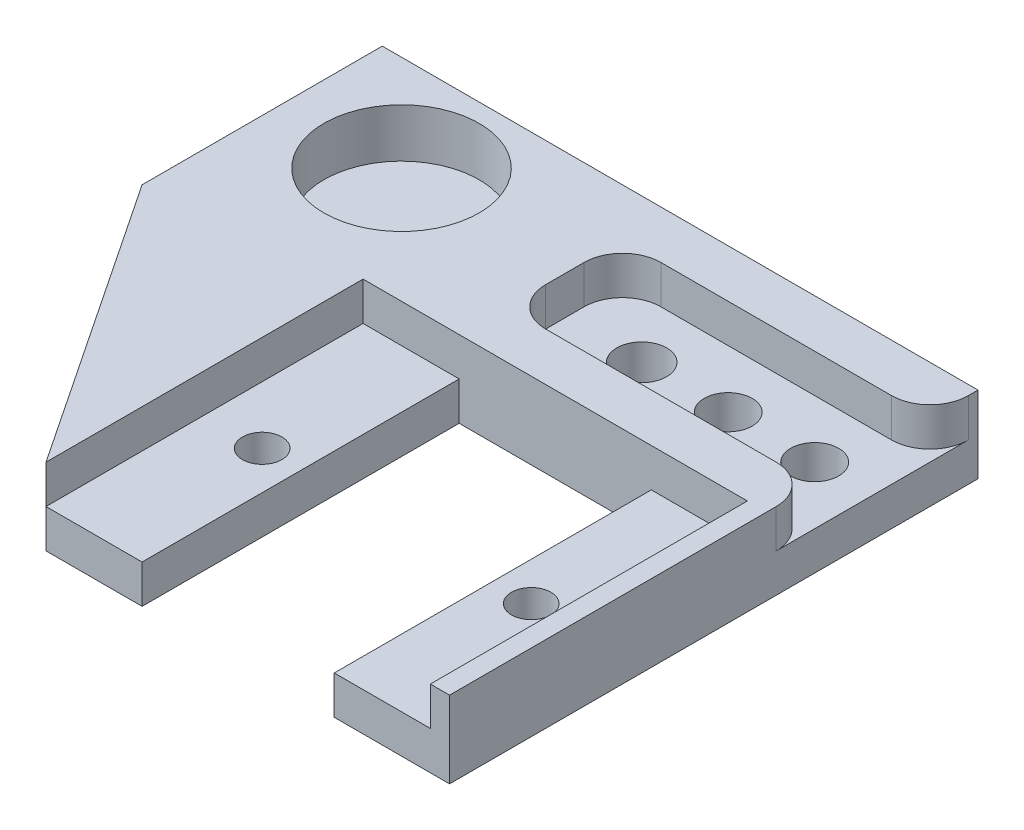
from build123d import *

# Parameters (mm, degrees)
EXTRUDE_1_DEPTH          = 2
EXTRUDE_2_DEPTH          = 3
SKETCH_3_W               = 16
SKETCH_3_H               = 60
EXTRUDE_3_DEPTH          = 3
CUT_EXTRUDE_1_DEPTH      = 1
CUT_EXTRUDE_2_DEPTH      = 69.543781629
SKETCH_6_W               = 20
SKETCH_6_H               = 16.5
CUT_EXTRUDE_4_DEPTH      = 2
CUT_EXTRUDE_6_DEPTH      = 69.543781629
CUT_EXTRUDE_6_DEPTH_BACK = 69.543781629
EXTRUDE_START            = -1
EXTRUDE_4_DEPTH          = 1
SKETCH_12_R              = 1
SKETCH_12_R_2            = 4
CUT_EXTRUDE_7_DEPTH      = 2.54
SKETCH_13_R              = 1.25
CUT_EXTRUDE_8_DEPTH      = 10
SKETCH_15_R              = 1
CUT_EXTRUDE_10_DEPTH     = 10
SKETCH_16_R              = 1.02
CUT_EXTRUDE_11_DEPTH     = 2
SKETCH_19_R              = 1.808389453
SKETCH_19_R_2            = 1.798107518
SKETCH_19_R_3            = 1.231148897
SKETCH_19_R_4            = 1.358627773
EXTRUDE_5_DEPTH          = 2
EXTRUDE_START_2          = -3
SKETCH_19_3_R            = 1.231148897
SKETCH_19_3_R_2          = 1.358627773
EXTRUDE_6_DEPTH          = 1
HOLE_WIZARD_M2_5_1_D     = 2.05
HOLE_WIZARD_M2_1_D       = 1.6
SKETCH_25_R              = 4.02
CUT_EXTRUDE_12_DEPTH     = 2.54
SKETCH_30_W              = 55.306598362
SKETCH_30_H              = 0.5
CUT_EXTRUDE_17_DEPTH     = 75.310646225
SKETCH_31_W              = 47.74998635
SKETCH_31_H              = 36.890870636
CUT_EXTRUDE_18_DEPTH     = 75.22986018
SKETCH_32_W              = 16
SKETCH_32_H              = 6
CUT_EXTRUDE_19_DEPTH     = 2
FILLET_2_R               = 2
SKETCH_33_R              = 1.25
CUT_EXTRUDE_20_DEPTH     = 2
SKETCH_35_R              = 4.02
EXTRUDE_7_DEPTH          = 4
SKETCH_36_R              = 4.04
CUT_EXTRUDE_21_DEPTH     = 2.54
SKETCH_37_W              = 31
SKETCH_37_H              = 0.5
CUT_EXTRUDE_22_DEPTH     = 10
SKETCH_38_R              = 1.3
CUT_EXTRUDE_23_DEPTH     = 44.324358045


with BuildPart() as part:
    # 草图1 → 凸台-拉伸1 (new body)
    with BuildSketch(Plane(origin=(0, 0, 0), x_dir=(1, 0, 0), z_dir=(0, 1, 0))):
        with BuildLine():
            Line((43, 1.5), (58.456841673, 3.534931811))
            ThreePointArc((58.456841673, 3.534931811), (61.401458892, 6.180320766), (59.995303837, 9.880534443))
            Line((59.995303837, 9.880534443), (31, 30))
            Line((31, 30), (10, 30))
            Line((10, 30), (0, 15))
            Line((0, 15), (0, -15))
            Line((0, -15), (10, -30))
            Line((10, -30), (31, -30))
            Line((31, -30), (59.995303837, -9.880534443))
            ThreePointArc((59.995303837, -9.880534443), (61.401458892, -6.180320766), (58.456841673, -3.534931811))
            Line((58.456841673, -3.534931811), (43, -1.5))
            Line((43, -1.5), (40, -1.5))
            Line((40, -1.5), (40, 1.5))
            Line((40, 1.5), (43, 1.5))
        make_face()
    extrude(amount=EXTRUDE_1_DEPTH)

    # 草图2 → 凸台-拉伸2 (add)
    with BuildSketch(Plane.XZ):
        Polygon((15, -30), (15, 30), (10, 30), (0, 15), (0, -15), (10, -30), align=None)
    extrude(amount=EXTRUDE_2_DEPTH)

    # 草图3 → 凸台-拉伸3 (add)
    with BuildSketch(Plane.XZ):
        with Locations((23, 0)):
            Rectangle(SKETCH_3_W, SKETCH_3_H)
    extrude(amount=EXTRUDE_3_DEPTH)

    # 草图5 → 切除-拉伸1 (cut)
    with BuildSketch(Plane.XZ.offset(3)):
        Polygon((10, -30), (31, -30), (31, 30), (10, 30), (0, 15), (0, -15), align=None)
    extrude(amount=-CUT_EXTRUDE_1_DEPTH, mode=Mode.SUBTRACT)

    # 草图4 → 切除-拉伸2 (cut, through all)
    with BuildSketch(Plane(origin=(0, 2, 0), x_dir=(1, 0, 0), z_dir=(0, 1, 0))):
        Polygon((15, -30.054194631), (25, -30), (25, -13.5), (15, -13.5), align=None)
        Polygon((25, 13.5), (15, 13.5), (15, 30.054194631), (25, 30), align=None)
    extrude(amount=-CUT_EXTRUDE_2_DEPTH, mode=Mode.SUBTRACT)

    # 草图6 → 切除-拉伸4 (cut)
    with BuildSketch(Plane(origin=(0, 2, 0), x_dir=(1, 0, 0), z_dir=(0, 1, 0))):
        with Locations((20, 21.75)):
            Rectangle(SKETCH_6_W, SKETCH_6_H)
        with Locations((20, -21.75)):
            Rectangle(SKETCH_6_W, SKETCH_6_H)
    extrude(amount=-CUT_EXTRUDE_4_DEPTH, mode=Mode.SUBTRACT)

    # 草图10 → 切除-拉伸6 (cut, two sides: drawn at the far end of the back side and taken through both)
    with BuildSketch(Plane(origin=(0, 2, 0), x_dir=(1, 0, 0), z_dir=(0, 1, 0)).offset(-CUT_EXTRUDE_6_DEPTH_BACK)):
        Polygon((40, -1.5), (-11.100796723, -1.5), (-3.854090755, 32.230988753), (54.203821011, 29.618804043), (85.46449539, 13.041941672), (77.376427304, 2.654316721), align=None)
    extrude(amount=CUT_EXTRUDE_6_DEPTH + CUT_EXTRUDE_6_DEPTH_BACK, mode=Mode.SUBTRACT)

    # 草图11 → 凸台-拉伸4 (add)
    with BuildSketch(Plane(origin=(0, 2, 0), x_dir=(1, 0, 0), z_dir=(0, 1, 0)).offset(EXTRUDE_START)):
        with BuildLine():
            Line((31, -34.868641247), (62.27565108, -13.166872292))
            ThreePointArc((62.27565108, -13.166872292), (65.15434027, -9.255636577), (65.033342884, -4.400744621))
            Line((65.033342884, -4.400744621), (58.456841673, -3.534931811))
            ThreePointArc((58.456841673, -3.534931811), (61.401458892, -6.180320766), (59.995303837, -9.880534443))
            Line((59.995303837, -9.880534443), (31, -30))
            Line((31, -30), (31, -34))
            Line((31, -34), (31, -34.868641247))
        make_face()
    extrude(amount=EXTRUDE_4_DEPTH)

    # 草图12 → 切除-拉伸7 (cut)
    with BuildSketch(Plane(origin=(0, 2, 0), x_dir=(1, 0, 0), z_dir=(0, 1, 0))):
        with Locations(Location((58, -7.004988826, 0), (0, 0, 270))):
            Circle(SKETCH_12_R)
        with Locations(Location((43, -6, 0), (0, 0, 270))):
            Circle(SKETCH_12_R)
        with Locations(Location((6, -7.25, 0), (0, 0, 270))):
            Circle(SKETCH_12_R_2)
    extrude(amount=-CUT_EXTRUDE_7_DEPTH, mode=Mode.SUBTRACT)

    # 草图13 → 切除-拉伸8 (cut)
    with BuildSketch(Plane(origin=(0, 0, 0), x_dir=(1, 0, 0), z_dir=(0, 1, 0))):
        with Locations(Location((13, -21.75, 0), (0, 0, 270))):
            Circle(SKETCH_13_R)
        with Locations(Location((27, -21.75, 0), (0, 0, 270))):
            Circle(SKETCH_13_R)
    extrude(amount=-CUT_EXTRUDE_8_DEPTH, mode=Mode.SUBTRACT)

    # 草图15 → 切除-拉伸10 (cut)
    with BuildSketch(Plane.XZ.offset(-1)):
        with Locations(Location((36, 29.573465579, 0), (0, 0, 270))):
            Circle(SKETCH_15_R)
        with Locations(Location((56, 15.695724776, 0), (0, 0, 270))):
            Circle(SKETCH_15_R)
    extrude(amount=-CUT_EXTRUDE_10_DEPTH, mode=Mode.SUBTRACT)

    # 草图16 → 切除-拉伸11 (cut)
    with BuildSketch(Plane.XZ):
        with Locations(Location((58, 7.004988826, 0), (0, 0, 270))):
            Circle(SKETCH_16_R)
        with Locations(Location((43, 6, 0), (0, 0, 270))):
            Circle(SKETCH_16_R)
    extrude(amount=-CUT_EXTRUDE_11_DEPTH, mode=Mode.SUBTRACT)

    # 草图19 → 凸台-拉伸5 (add)
    with BuildSketch(Plane.XZ.offset(2)):
        with Locations((13, 21.75)):
            Circle(SKETCH_19_R)
        with Locations((27, 21.75)):
            Circle(SKETCH_19_R_2)
        with Locations((36, 29.573465579)):
            Circle(SKETCH_19_R_3)
        with Locations((56, 15.695724776)):
            Circle(SKETCH_19_R_4)
    extrude(amount=-EXTRUDE_5_DEPTH)


with BuildPart() as extrude_5_kept_piece:
    # of the separate pieces the step leaves, the one the design keeps (extrude_5_pieces_kept)
    add(part.part.solids().sort_by_distance((58.456841673, 0, 3.534931811))[0])

    # 草图19<3> → 凸台-拉伸6 (add)
    with BuildSketch(Plane.XZ.offset(2).offset(EXTRUDE_START_2)):
        with Locations((36, 29.573465579)):
            Circle(SKETCH_19_3_R)
        with Locations((56, 15.695724776)):
            Circle(SKETCH_19_3_R_2)
    extrude(amount=-EXTRUDE_6_DEPTH)

    # M2.5 螺纹孔1 (through all)
    with Locations(Plane(origin=(0, -2, 0), x_dir=(-1, 0, 0), z_dir=(0, -1, 0))):
        with Locations((-27, -21.75), (-13, -21.75)):
            Hole(HOLE_WIZARD_M2_5_1_D / 2)

    # M2 螺纹孔1 (through all)
    with Locations(Plane(origin=(0, 1, 0), x_dir=(-1, 0, 0), z_dir=(0, -1, 0))):
        with Locations((-56, -15.695724776), (-36, -29.573465579)):
            Hole(HOLE_WIZARD_M2_1_D / 2)

    # 草图25 → 切除-拉伸12 (cut)
    with BuildSketch(Plane(origin=(0, 2, 0), x_dir=(1, 0, 0), z_dir=(0, 1, 0))):
        with Locations(Location((6, -7.25, 0), (0, 0, 270))):
            Circle(SKETCH_25_R)
    extrude(amount=-CUT_EXTRUDE_12_DEPTH, mode=Mode.SUBTRACT)

    # 草图30 → 切除-拉伸17 (cut, through all)
    with BuildSketch(Plane.XZ.offset(2)):
        with Locations((27.653299181, 1.75)):
            Rectangle(SKETCH_30_W, SKETCH_30_H)
    extrude(amount=-CUT_EXTRUDE_17_DEPTH, mode=Mode.SUBTRACT)

    # 草图31 → 切除-拉伸18 (cut, through all)
    with BuildSketch(Plane.XZ):
        with Locations((54.874993175, 20.445435318)):
            Rectangle(SKETCH_31_W, SKETCH_31_H)
    extrude(amount=-CUT_EXTRUDE_18_DEPTH, mode=Mode.SUBTRACT)

    # 草图32 → 切除-拉伸19 (cut)
    with BuildSketch(Plane(origin=(0, 2, 0), x_dir=(1, 0, 0), z_dir=(0, 1, 0))):
        with Locations((23, -8)):
            Rectangle(SKETCH_32_W, SKETCH_32_H)
    extrude(amount=-CUT_EXTRUDE_19_DEPTH, mode=Mode.SUBTRACT)

    # 圆角2
    fillet_2_edges = [extrude_5_kept_piece.edges().sort_by_distance(p)[0] for p in [
        (31, 1, 5),
        (31, 1, 11),
        (15, 1, 11),
        (15, 1, 5),
    ]]
    fillet(fillet_2_edges, radius=FILLET_2_R)

    # 草图33 → 切除-拉伸20 (cut)
    with BuildSketch(Plane(origin=(0, 0, 0), x_dir=(1, 0, 0), z_dir=(0, 1, 0))):
        with Locations(Location((19, -8, 0), (0, 0, 270))):
            Circle(SKETCH_33_R)
        with Locations(Location((23.5, -8, 0), (0, 0, 270))):
            Circle(SKETCH_33_R)
        with Locations(Location((28, -8, 0), (0, 0, 270))):
            Circle(SKETCH_33_R)
    extrude(amount=-CUT_EXTRUDE_20_DEPTH, mode=Mode.SUBTRACT)

    # 草图35 → 凸台-拉伸7 (add)
    with BuildSketch(Plane(origin=(0, 2, 0), x_dir=(1, 0, 0), z_dir=(0, 1, 0))):
        with Locations((6, -7.25)):
            Circle(SKETCH_35_R)
    extrude(amount=-EXTRUDE_7_DEPTH)

    # 草图36 → 切除-拉伸21 (cut)
    with BuildSketch(Plane(origin=(0, 2, 0), x_dir=(1, 0, 0), z_dir=(0, 1, 0))):
        with Locations(Location((6, -7.5, 0), (0, 0, 270))):
            Circle(SKETCH_36_R)
    extrude(amount=-CUT_EXTRUDE_21_DEPTH, mode=Mode.SUBTRACT)

    # 草图37 → 切除-拉伸22 (cut)
    with BuildSketch(Plane(origin=(0, 2, 0), x_dir=(1, 0, 0), z_dir=(0, 1, 0))):
        with Locations((15.5, -2.25)):
            Rectangle(SKETCH_37_W, SKETCH_37_H)
    extrude(amount=-CUT_EXTRUDE_22_DEPTH, mode=Mode.SUBTRACT)

    # 草图38 → 切除-拉伸23 (cut, through all)
    with BuildSketch(Plane.XZ.offset(2)):
        with Locations(Location((19, 8, 0), (0, 0, 270))):
            Circle(SKETCH_38_R)
    extrude(amount=-CUT_EXTRUDE_23_DEPTH, mode=Mode.SUBTRACT)


solid = extrude_5_kept_piece.part
